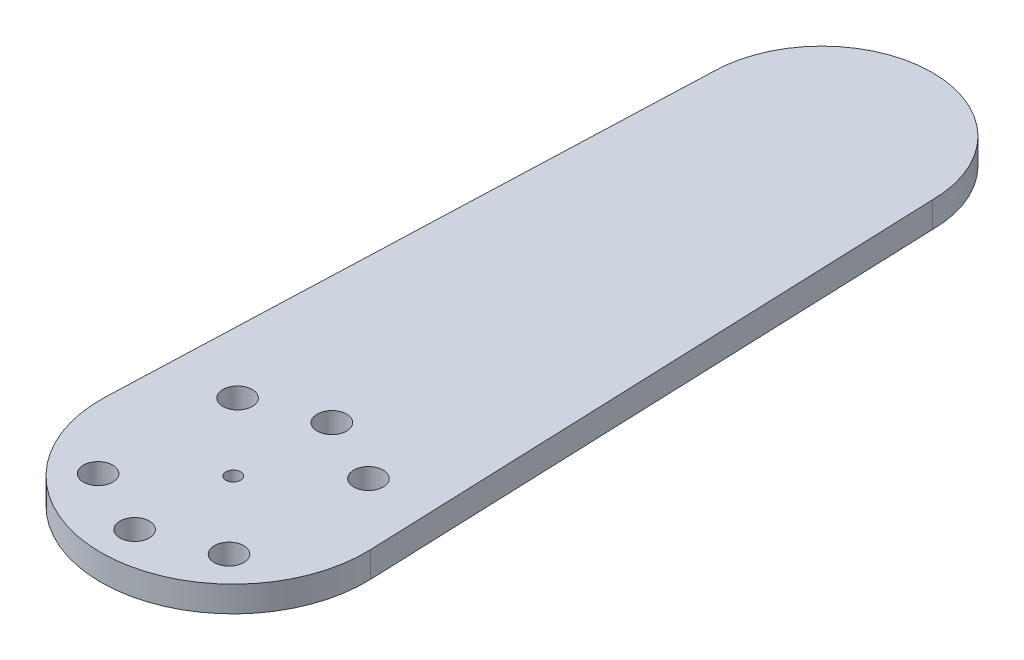
from build123d import *

# Parameters (mm, degrees)
SKETCH_1_R          = 1
EXTRUDE_1_DEPTH     = 3.5
SKETCH_2_R          = 2
CUT_EXTRUDE_1_DEPTH = 97.753552906


with BuildPart() as part:
    # Эскиз1 → Вытянуть1 (new body)
    with BuildSketch(Plane(origin=(0, 0, 0), x_dir=(1, 0, 0), z_dir=(0, 1, 0))):
        with BuildLine():
            Line((-15, 80), (-17.987249423, 0.677390733))
            ThreePointArc((-17.987249423, 0.677390733), (0, -18), (17.987249423, 0.677390733))
            Line((17.987249423, 0.677390733), (15, 80))
            ThreePointArc((15, 80), (0, 95), (-15, 80))
        make_face()
        with Locations(Location((0, 0, 0), (0, 0, 270))):
            Circle(SKETCH_1_R, mode=Mode.SUBTRACT)
    extrude(amount=EXTRUDE_1_DEPTH)

    # Эскиз2 → Вырез-Вытянуть1 (cut, through all)
    with BuildSketch(Plane.XZ):
        with Locations(Location((-0.408986403, 12.99356495, 0), (0, 0, 270))):
            Circle(SKETCH_2_R)
        with Locations(Location((-9.477034947, 8.898640829, 0), (0, 0, 270))):
            Circle(SKETCH_2_R)
        with Locations(Location((8.898640829, 9.477034947, 0), (0, 0, 270))):
            Circle(SKETCH_2_R)
        with Locations(Location((9.477034947, -8.898640829, 0), (0, 0, 270))):
            Circle(SKETCH_2_R)
        with Locations(Location((0.408986403, -12.99356495, 0), (0, 0, 270))):
            Circle(SKETCH_2_R)
        with Locations(Location((-8.898640829, -9.477034947, 0), (0, 0, 270))):
            Circle(SKETCH_2_R)
    extrude(amount=-CUT_EXTRUDE_1_DEPTH, mode=Mode.SUBTRACT)


solid = part.part
